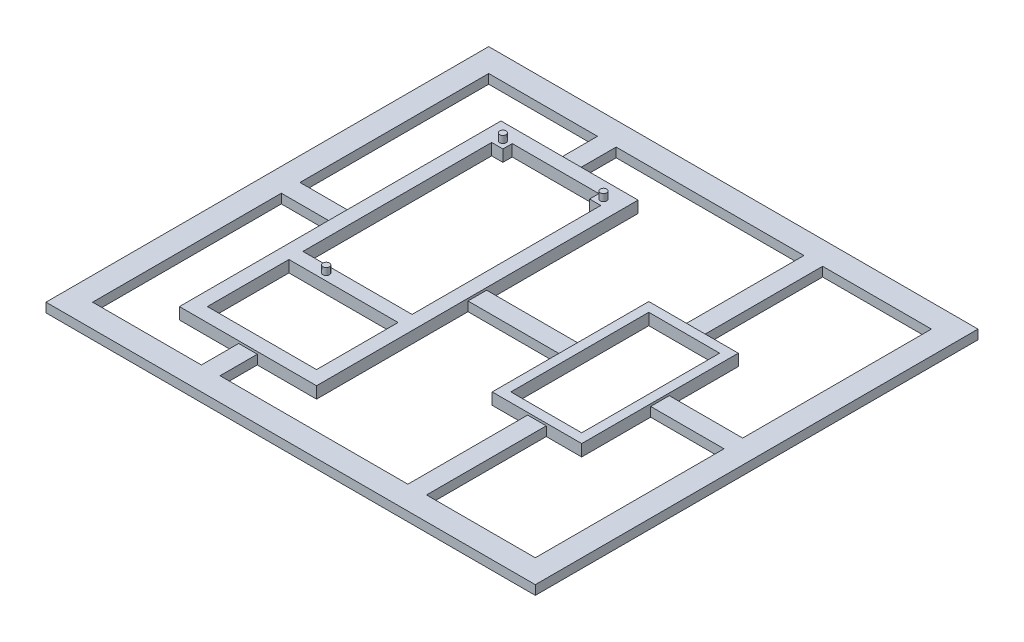
from build123d import *

# Parameters (mm, degrees)
SKETCH2_W           = 29.42
SKETCH2_H           = 69
SKETCH2_W_2         = 23.42
SKETCH2_H_2         = 17.5
BOSS_EXTRUDE1_DEPTH = 2.5
SKETCH2_3_R         = 0.7
BOSS_EXTRUDE2_DEPTH = 4
SKETCH3_W           = 19.2
SKETCH3_H           = 33.6
SKETCH3_W_2         = 15.2
SKETCH3_H_2         = 29.6
BOSS_EXTRUDE3_DEPTH = 2.5
SKETCH4_W           = 105
SKETCH4_H           = 95
SKETCH4_W_2         = 20
SKETCH4_H_2         = 4
BOSS_EXTRUDE4_DEPTH = 2


with BuildPart() as part:
    # Sketch2 → Boss-Extrude1 (new body)
    with BuildSketch(Plane(origin=(0, 0, 0), x_dir=(1, 0, 0), z_dir=(0, 1, 0))):
        Rectangle(SKETCH2_W, SKETCH2_H)
        Polygon((11.71, -11), (-11.71, -11), (-11.71, 29.5), (-9.3, 29.5), (-9.3, 31.5), (9.3, 31.5), (9.3, 29.5), (11.71, 29.5), align=None, mode=Mode.SUBTRACT)
        with Locations((0, -22.75)):
            Rectangle(SKETCH2_W_2, SKETCH2_H_2, mode=Mode.SUBTRACT)
    extrude(amount=BOSS_EXTRUDE1_DEPTH)

    # Sketch2<3> → Boss-Extrude2 (add)
    with BuildSketch(Plane(origin=(0, 0, 0), x_dir=(1, 0, 0), z_dir=(0, 1, 0))):
        with Locations(Location((-10.8, 31, 0), (0, 0, 270))):
            Circle(SKETCH2_3_R)
        with Locations(Location((-5.21, -12.5, 0), (0, 0, 270))):
            Circle(SKETCH2_3_R)
        with Locations(Location((10.8, 31, 0), (0, 0, 90))):
            Circle(SKETCH2_3_R)
    extrude(amount=BOSS_EXTRUDE2_DEPTH)



with BuildPart() as body_2:
    # Sketch3 → Boss-Extrude3 (new body)
    with BuildSketch(Plane(origin=(0, 0, 0), x_dir=(1, 0, 0), z_dir=(0, 1, 0))):
        with Locations((44.31, 0)):
            Rectangle(SKETCH3_W, SKETCH3_H)
        with Locations((44.31, 0)):
            Rectangle(SKETCH3_W_2, SKETCH3_H_2, mode=Mode.SUBTRACT)
    extrude(amount=BOSS_EXTRUDE3_DEPTH)


with BuildPart() as part_1:
    add(part.part)

    add(body_2.part)  # Boss-Extrude4 merges body 2
    # Sketch4 → Boss-Extrude4 (add)
    # profile 1 of 2: a face of its own
    with BuildSketch(Plane(origin=(0, 0, 0), x_dir=(1, 0, 0), z_dir=(0, 1, 0))):
        with Locations((22.155, 0)):
            Rectangle(SKETCH4_W, SKETCH4_H)
        Polygon((-25.345, -42.5), (-25.345, -2), (-14.71, -2), (-14.71, 2), (-25.345, 2), (-25.345, 42.5), (-2, 42.5), (-2, 34.5), (2, 34.5), (2, 42.5), (42.31, 42.5), (42.31, 16.8), (46.31, 16.8), (46.31, 42.5), (69.655, 42.5), (69.655, 2), (53.91, 2), (53.91, -2), (69.655, -2), (69.655, -42.5), (46.31, -42.5), (46.31, -16.8), (42.31, -16.8), (42.31, -42.5), (2, -42.5), (2, -34.5), (-2, -34.5), (-2, -42.5), align=None, mode=Mode.SUBTRACT)
    # profile 2 of 2: a face of its own
    with BuildSketch(Plane(origin=(0, 0, 0), x_dir=(1, 0, 0), z_dir=(0, 1, 0))):
        with Locations((24.71, 0)):
            Rectangle(SKETCH4_W_2, SKETCH4_H_2)
    extrude(amount=BOSS_EXTRUDE4_DEPTH)


solid = part_1.part
